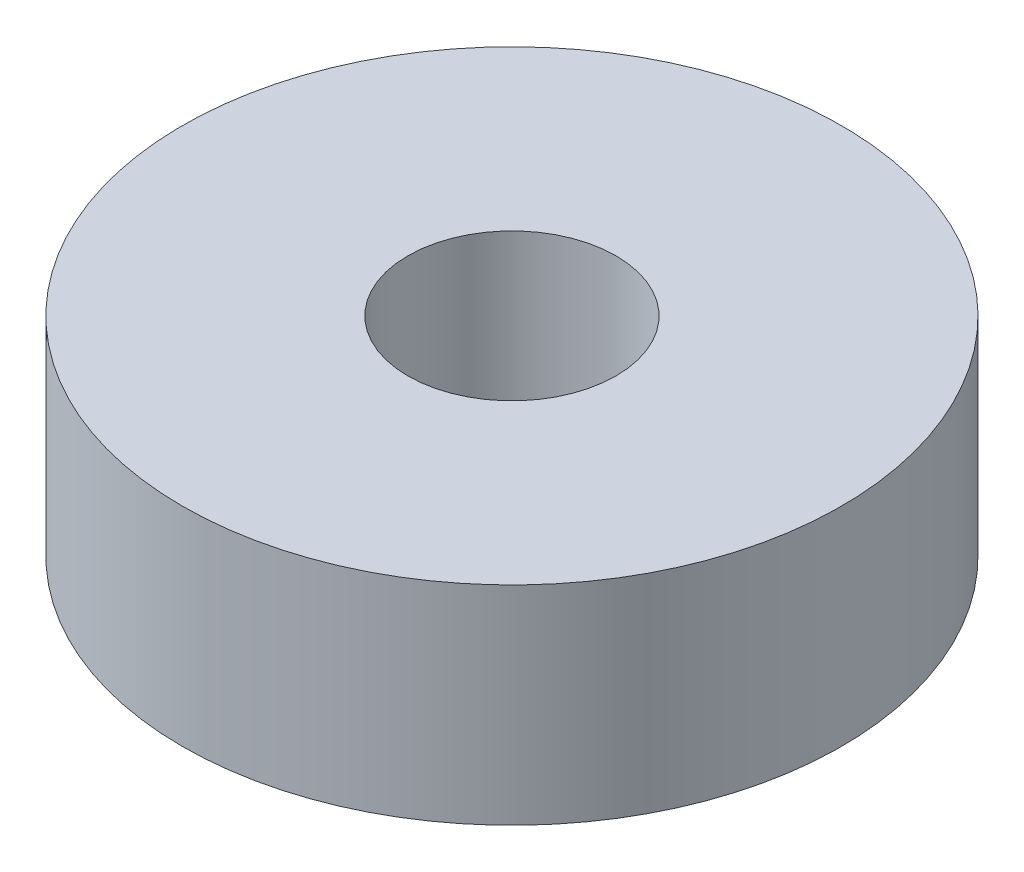
from build123d import *

# Parameters (mm, degrees)
SKETCH1_R           = 9.5
SKETCH1_R_2         = 3
BOSS_EXTRUDE1_DEPTH = 6


with BuildPart() as part:
    # Sketch1 → Boss-Extrude1 (new body)
    with BuildSketch(Plane(origin=(0, 0, 0), x_dir=(1, 0, 0), z_dir=(0, 1, 0))):
        with Locations(Location((0, 0, 0), (0, 0, 270))):
            Circle(SKETCH1_R)
        with Locations(Location((0, 0, 0), (0, 0, 270))):
            Circle(SKETCH1_R_2, mode=Mode.SUBTRACT)
    extrude(amount=BOSS_EXTRUDE1_DEPTH)


solid = part.part
